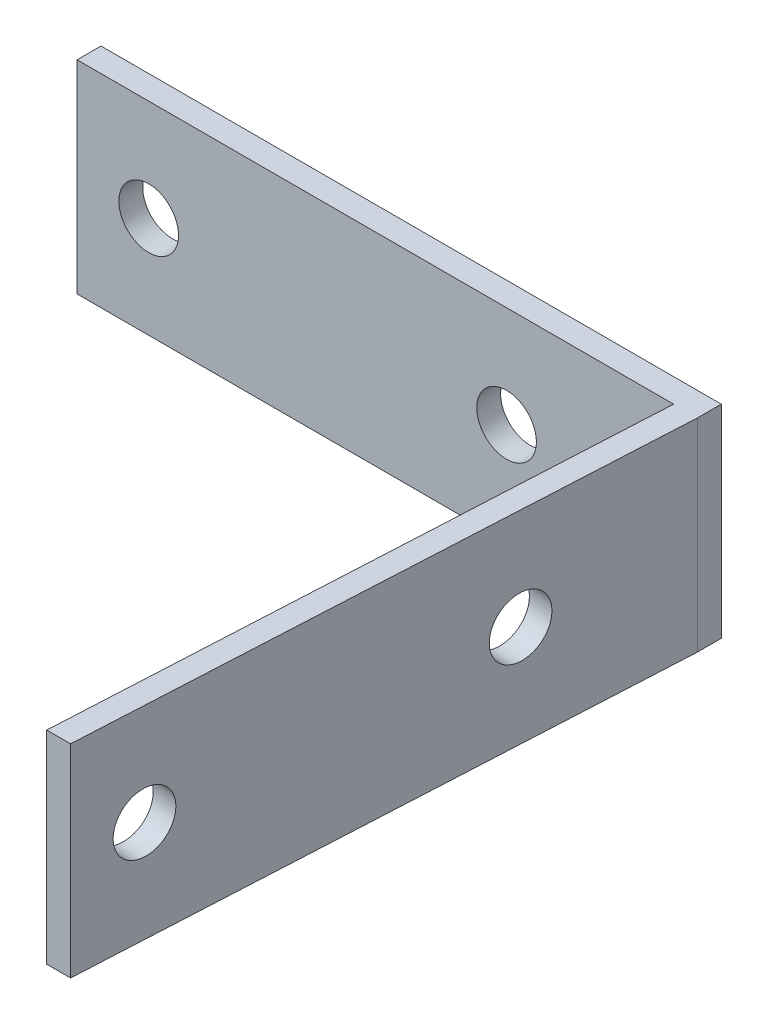
from build123d import *

# Parameters (mm, degrees)
ESQUISSE1_W             = 52
ESQUISSE1_H             = 17
BOSS_EXTRU_1_DEPTH      = 2
ESQUISSE2_W             = 2
ESQUISSE2_H             = 17
BOSS_EXTRU_2_DEPTH      = 50
ESQUISSE3_R             = 2.5
ENL_V_MAT_EXTRU_1_DEPTH = 50
ESQUISSE4_R             = 2.5
ENL_V_MAT_EXTRU_2_DEPTH = 50


with BuildPart() as part:
    # Esquisse1 → Boss.-Extru.1 (new body)
    with BuildSketch(Plane.XY):
        Rectangle(ESQUISSE1_W, ESQUISSE1_H)
    extrude(amount=BOSS_EXTRU_1_DEPTH)

    # Esquisse2 → Boss.-Extru.2 (add, along a direction that is not the sketch's normal)
    with BuildSketch(Plane.XY.offset(2)):
        with Locations((25, 0)):
            Rectangle(ESQUISSE2_W, ESQUISSE2_H)
    extrude(amount=BOSS_EXTRU_2_DEPTH, dir=(-0.052335956242937125, 0, 0.9986295347545743))

    # Esquisse3 → Enlèv. mat.-Extru.1 (cut)
    with BuildSketch(Plane.XY.offset(2)):
        with Locations((-20, 0)):
            Circle(ESQUISSE3_R)
        with Locations((10, 0)):
            Circle(ESQUISSE3_R)
    extrude(amount=-ENL_V_MAT_EXTRU_1_DEPTH, mode=Mode.SUBTRACT)

    # Esquisse4 → Enlèv. mat.-Extru.2 (cut)
    with BuildSketch(Plane(origin=(24.038791208, 0, 1.259819664), x_dir=(-0.052335956242937125, 0, 0.9986295347545743), z_dir=(-0.9986295347545743, 0, -0.052335956242937125))):
        with Locations((44.74119612, 0)):
            Circle(ESQUISSE4_R)
        with Locations((14.74119612, 0)):
            Circle(ESQUISSE4_R)
    extrude(amount=-ENL_V_MAT_EXTRU_2_DEPTH, mode=Mode.SUBTRACT)


solid = part.part
